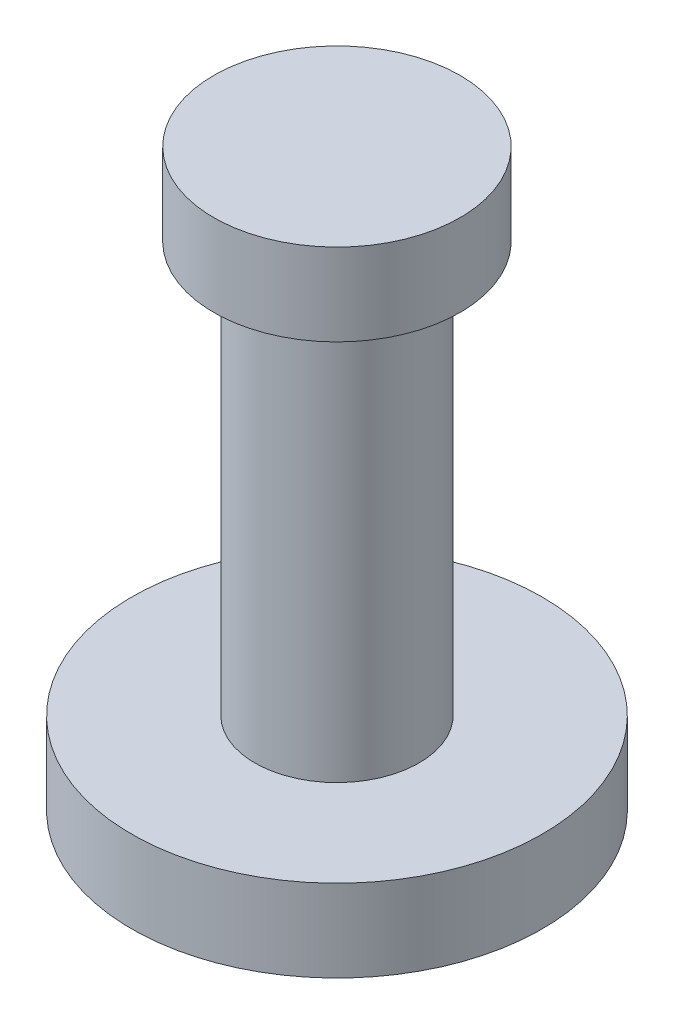
from build123d import *


with BuildPart() as part:
    # 草图1 → 旋转1 (revolve)
    with BuildSketch(Plane.XY, mode=Mode.PRIVATE) as revolve_1_sk:
        Polygon((-42.42146862, -10), (-17.42146862, -10), (-17.42146862, 60), (-32.42146862, 60), (-32.42146862, 50), (-27.42146862, 50), (-27.42146862, 0), (-42.42146862, 0), align=None)
    revolve(revolve_1_sk.sketch.rotate(Axis((-17.42146862, -10, 0), (0, 1, 0)), 270), axis=Axis((-17.42146862, -10, 0), (0, 1, 0)))


solid = part.part
